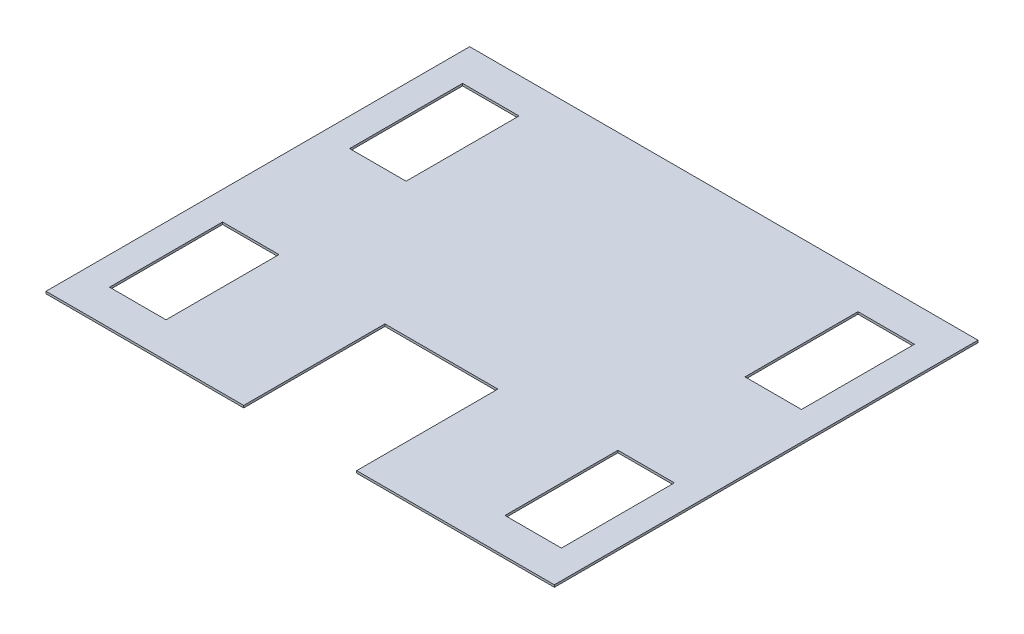
from build123d import *

# Parameters (mm, degrees)
SKETCH1_W           = 457.2
SKETCH1_H           = 381
BOSS_EXTRUDE1_DEPTH = 2
SKETCH119_W         = 50.8
SKETCH119_H         = 101.6
CUT_EXTRUDE1_DEPTH  = 298.577233672
SKETCH120_W         = 101.6
SKETCH120_H         = 127
CUT_EXTRUDE2_DEPTH  = 298.577233672


with BuildPart() as part:
    # Sketch1 → Boss-Extrude1 (new body)
    with BuildSketch(Plane(origin=(0, 0, 0), x_dir=(1, 0, 0), z_dir=(0, 1, 0))):
        Rectangle(SKETCH1_W, SKETCH1_H)
    extrude(amount=BOSS_EXTRUDE1_DEPTH)

    # Sketch119 → Cut-Extrude1 (cut, through all)
    with BuildSketch(Plane(origin=(0, 2, 0), x_dir=(1, 0, 0), z_dir=(0, 1, 0))):
        with Locations((-177.8, 107.95)):
            Rectangle(SKETCH119_W, SKETCH119_H)
        with Locations((177.8, 107.95)):
            Rectangle(SKETCH119_W, SKETCH119_H)
        with Locations((177.8, -107.95)):
            Rectangle(SKETCH119_W, SKETCH119_H)
        with Locations((-177.8, -107.95)):
            Rectangle(SKETCH119_W, SKETCH119_H)
    extrude(amount=-CUT_EXTRUDE1_DEPTH, mode=Mode.SUBTRACT)

    # Sketch120 → Cut-Extrude2 (cut, through all)
    with BuildSketch(Plane(origin=(0, 2, 0), x_dir=(1, 0, 0), z_dir=(0, 1, 0))):
        with Locations((0, -127)):
            Rectangle(SKETCH120_W, SKETCH120_H)
    extrude(amount=-CUT_EXTRUDE2_DEPTH, mode=Mode.SUBTRACT)


solid = part.part
